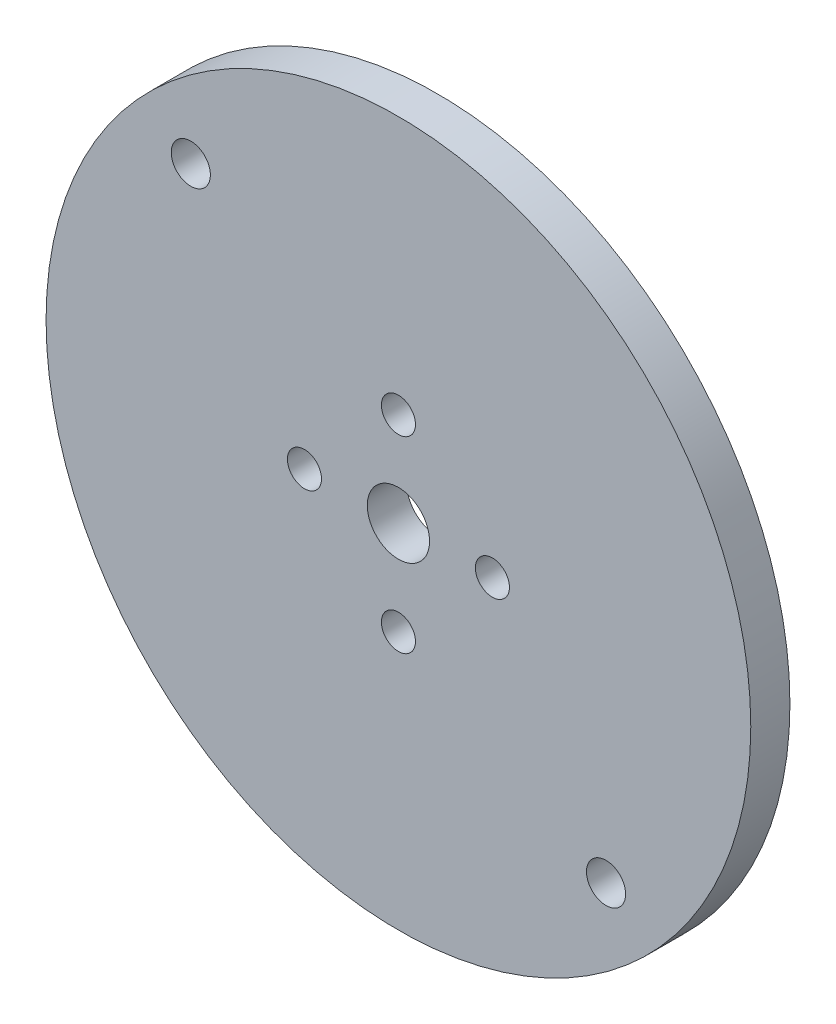
from build123d import *

# Parameters (mm, degrees)
SKETCH1_R           = 45
SKETCH1_R_2         = 2.175
SKETCH1_R_3         = 3.975
SKETCH1_R_4         = 2.5
BOSS_EXTRUDE1_DEPTH = 5


with BuildPart() as part:
    # Sketch1 → Boss-Extrude1 (new body)
    with BuildSketch(Plane.XY):
        Circle(SKETCH1_R)
        with Locations((12, 0)):
            Circle(SKETCH1_R_2, mode=Mode.SUBTRACT)
        with Locations((0, 12)):
            Circle(SKETCH1_R_2, mode=Mode.SUBTRACT)
        with Locations((-12, 0)):
            Circle(SKETCH1_R_2, mode=Mode.SUBTRACT)
        with Locations((0, -12)):
            Circle(SKETCH1_R_2, mode=Mode.SUBTRACT)
        Circle(SKETCH1_R_3, mode=Mode.SUBTRACT)
        with Locations((-26.516504294, 26.516504294)):
            Circle(SKETCH1_R_4, mode=Mode.SUBTRACT)
        with Locations((26.516504294, -26.516504294)):
            Circle(SKETCH1_R_4, mode=Mode.SUBTRACT)
    extrude(amount=BOSS_EXTRUDE1_DEPTH)


solid = part.part
